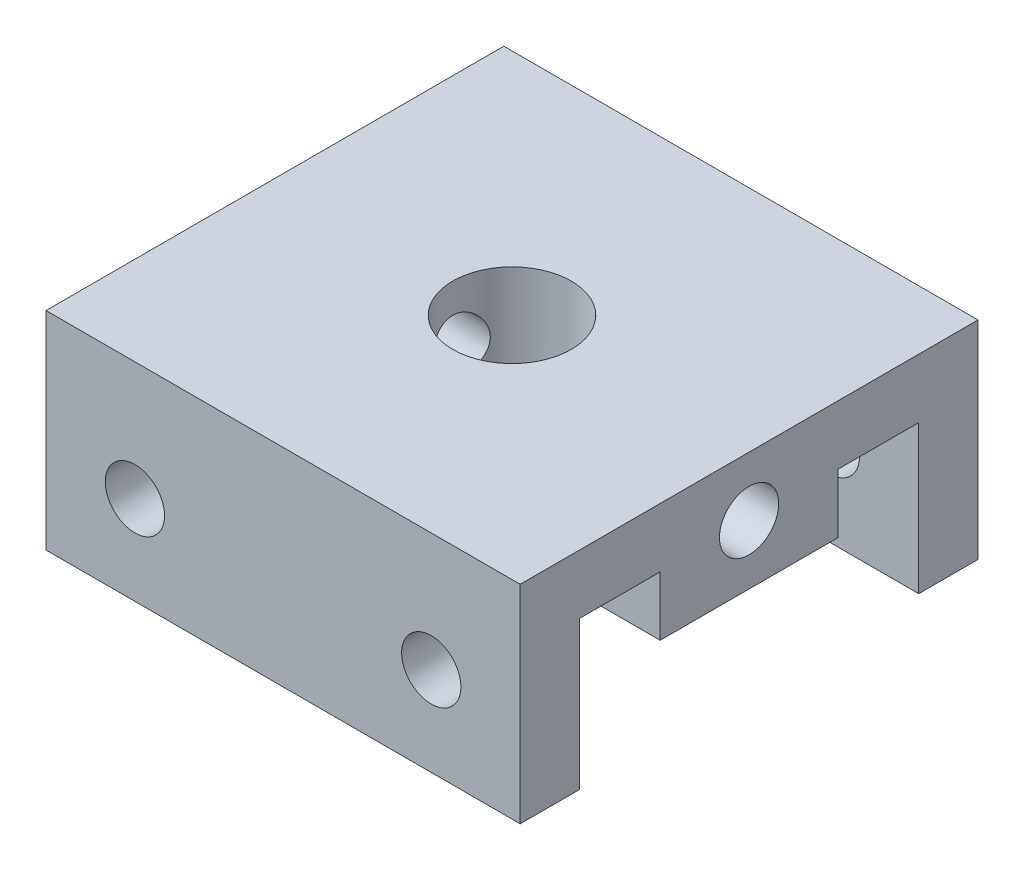
from build123d import *

# Parameters (mm, degrees)
BOSS_EXTRUDE2_DEPTH      = 25.4
BOSS_EXTRUDE2_DEPTH_BACK = 25.4
SKETCH3_R                = 3.175
CUT_EXTRUDE1_DEPTH       = 50.8
BOSS_EXTRUDE3_DEPTH      = 6.35
SKETCH4_R                = 6.35
CUT_EXTRUDE2_DEPTH       = 50.8
SKETCH8_R                = 3.175
CUT_EXTRUDE3_DEPTH       = 61.630559774


with BuildPart() as part:
    # Sketch1 → Boss-Extrude2 (new, two sides: drawn at the far end of the back side and taken through both)
    with BuildSketch(Plane(origin=(0, 0, 0), x_dir=(0, 0, -1), z_dir=(1, 0, 0)).offset(-BOSS_EXTRUDE2_DEPTH_BACK)):
        Polygon((18.17497, -22.225), (24.52497, -22.225), (24.52497, 0), (-24.52497, 0), (-24.52497, -22.225), (-18.17497, -22.225), (-18.17497, -6.35), (18.17497, -6.35), align=None)
    extrude(amount=BOSS_EXTRUDE2_DEPTH + BOSS_EXTRUDE2_DEPTH_BACK)

    # Sketch3 → Cut-Extrude1 (cut)
    with BuildSketch(Plane.XY.offset(24.52497)):
        with Locations((-15.875, -12.7)):
            Circle(SKETCH3_R)
        with Locations((15.875, -12.7)):
            Circle(SKETCH3_R)
    extrude(amount=-CUT_EXTRUDE1_DEPTH, mode=Mode.SUBTRACT)

    # Sketch7 → Boss-Extrude3 (add)
    with BuildSketch(Plane.XZ.offset(6.35)):
        Polygon((-25.4, 9.525), (0, 9.525), (25.4, 9.525), (25.4, -9.525), (-1.632648861, -9.525), (-25.4, -9.525), align=None)
    extrude(amount=BOSS_EXTRUDE3_DEPTH)

    # Sketch4 → Cut-Extrude2 (cut)
    with BuildSketch(Plane(origin=(0, 0, 0), x_dir=(1, 0, 0), z_dir=(0, 1, 0))):
        Circle(SKETCH4_R)
    extrude(amount=-CUT_EXTRUDE2_DEPTH, mode=Mode.SUBTRACT)

    # Sketch8 → Cut-Extrude3 (cut, through all)
    with BuildSketch(Plane.ZY.offset(25.4)):
        with Locations((0, -6.35)):
            Circle(SKETCH8_R)
    extrude(amount=-CUT_EXTRUDE3_DEPTH, mode=Mode.SUBTRACT)


solid = part.part
